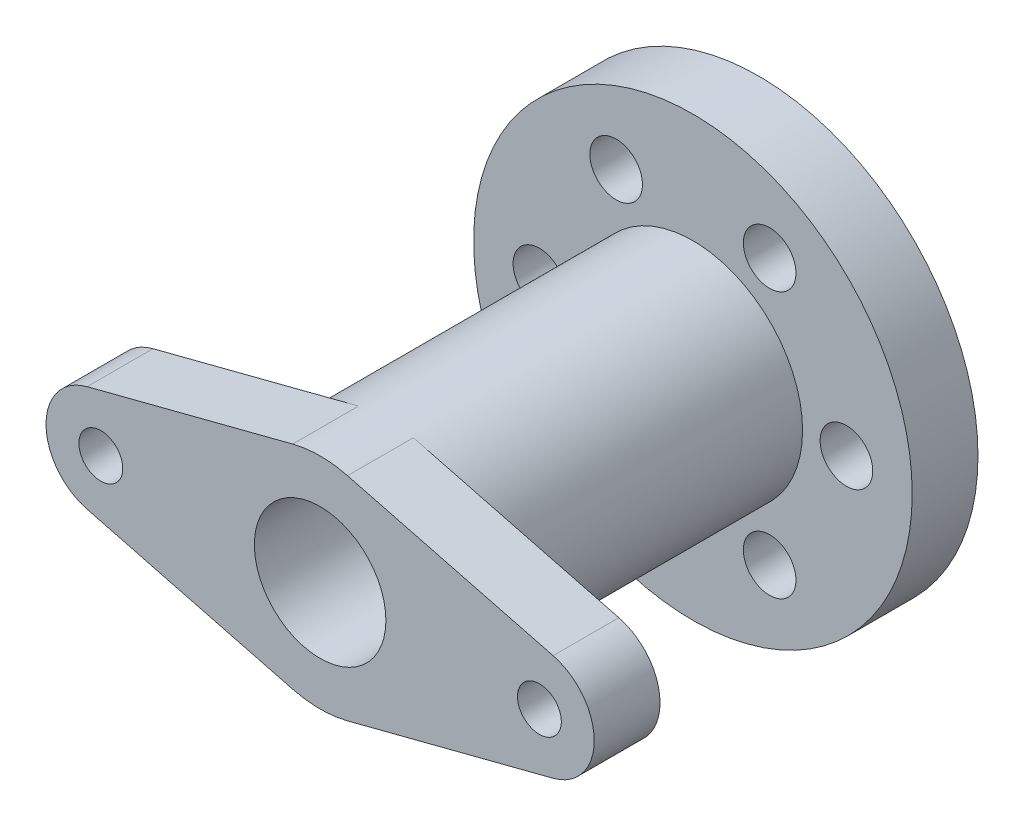
from build123d import *
from build123d.topology import SkipClean

# Parameters (mm, degrees)
BOSS_EXTRUDE1_START         = 15
SKETCH2_R                   = 5
BOSS_EXTRUDE1_DEPTH         = 15
SKETCH3_R                   = 15
CUT_EXTRUDE1_DEPTH          = 100
F_12_0MM_DOWEL_HOLE1_REACH  = 130.087
F_12_0MM_DOWEL_HOLE1_BORE_R = 6


with BuildPart() as part:
    # Sketch1 → Revolve1 (revolve)
    with BuildSketch(Plane(origin=(0, 0, 0), x_dir=(0, 0, -1), z_dir=(1, 0, 0)), mode=Mode.PRIVATE) as revolve1_sk:
        Polygon((85, 0), (85, 50), (70, 50), (70, 25), (0, 25), (0, 0), align=None)
    revolve(revolve1_sk.sketch.rotate(Axis((0, 0, 0), (0, 0, -1)), 90), axis=Axis((0, 0, 0), (0, 0, -1)))

    # Sketch2 → Boss-Extrude1 (add)
    with SkipClean():  # the faces are left unmerged after this step: merging them gives an invalid solid
        with BuildSketch(Plane.XY.offset(BOSS_EXTRUDE1_START)):
            with BuildLine():
                Line((-6.25, 24.206145914), (-53.125, 12.103072957))
                ThreePointArc((-53.125, 12.103072957), (-62.5, 0), (-53.125, -12.103072957))
                Line((-53.125, -12.103072957), (-6.25, -24.206145914))
                ThreePointArc((-6.25, -24.206145914), (0, -25), (6.25, -24.206145914))
                Line((6.25, -24.206145914), (53.125, -12.103072957))
                ThreePointArc((53.125, -12.103072957), (62.5, 0), (53.125, 12.103072957))
                Line((53.125, 12.103072957), (6.25, 24.206145914))
                ThreePointArc((6.25, 24.206145914), (0, 25), (-6.25, 24.206145914))
            make_face()
            with Locations((-50, 0)):
                Circle(SKETCH2_R, mode=Mode.SUBTRACT)
            with Locations((50, 0)):
                Circle(SKETCH2_R, mode=Mode.SUBTRACT)
        extrude(amount=-BOSS_EXTRUDE1_DEPTH)

    # Sketch3 → Cut-Extrude1 (cut)
    with SkipClean():  # the faces are left unmerged after this step: merging them gives an invalid solid
        with BuildSketch(Plane.XY.offset(15)):
            Circle(SKETCH3_R)
        extrude(amount=-CUT_EXTRUDE1_DEPTH, mode=Mode.SUBTRACT)

    # Ø12.0mm Dowel Hole1 bore → Ø12.0mm Dowel Hole1 (cut, up to next)
    with BuildSketch(Plane(origin=(0, 0, -85), x_dir=(-1, 0, 0), z_dir=(0, 0, -1)), mode=Mode.PRIVATE) as f_12_0mm_dowel_hole1_sk1:
        with Locations((-17.5, -30.310889132)):
            Circle(F_12_0MM_DOWEL_HOLE1_BORE_R)
    f_12_0mm_dowel_hole1_tool1 = extrude(f_12_0mm_dowel_hole1_sk1.sketch, amount=-F_12_0MM_DOWEL_HOLE1_REACH, mode=Mode.PRIVATE) & part.part
    # Ø12.0mm Dowel Hole1 bore → Ø12.0mm Dowel Hole1 (cut, up to next)
    with BuildSketch(Plane(origin=(0, 0, -85), x_dir=(-1, 0, 0), z_dir=(0, 0, -1)), mode=Mode.PRIVATE) as f_12_0mm_dowel_hole1_sk2:
        with Locations((-35, 0)):
            Circle(F_12_0MM_DOWEL_HOLE1_BORE_R)
    f_12_0mm_dowel_hole1_tool2 = extrude(f_12_0mm_dowel_hole1_sk2.sketch, amount=-F_12_0MM_DOWEL_HOLE1_REACH, mode=Mode.PRIVATE) & part.part
    # Ø12.0mm Dowel Hole1 bore → Ø12.0mm Dowel Hole1 (cut, up to next)
    with BuildSketch(Plane(origin=(0, 0, -85), x_dir=(-1, 0, 0), z_dir=(0, 0, -1)), mode=Mode.PRIVATE) as f_12_0mm_dowel_hole1_sk3:
        with Locations((-17.5, 30.310889132)):
            Circle(F_12_0MM_DOWEL_HOLE1_BORE_R)
    f_12_0mm_dowel_hole1_tool3 = extrude(f_12_0mm_dowel_hole1_sk3.sketch, amount=-F_12_0MM_DOWEL_HOLE1_REACH, mode=Mode.PRIVATE) & part.part
    # Ø12.0mm Dowel Hole1 bore → Ø12.0mm Dowel Hole1 (cut, up to next)
    with BuildSketch(Plane(origin=(0, 0, -85), x_dir=(-1, 0, 0), z_dir=(0, 0, -1)), mode=Mode.PRIVATE) as f_12_0mm_dowel_hole1_sk4:
        with Locations((17.5, 30.310889132)):
            Circle(F_12_0MM_DOWEL_HOLE1_BORE_R)
    f_12_0mm_dowel_hole1_tool4 = extrude(f_12_0mm_dowel_hole1_sk4.sketch, amount=-F_12_0MM_DOWEL_HOLE1_REACH, mode=Mode.PRIVATE) & part.part
    # Ø12.0mm Dowel Hole1 bore → Ø12.0mm Dowel Hole1 (cut, up to next)
    with BuildSketch(Plane(origin=(0, 0, -85), x_dir=(-1, 0, 0), z_dir=(0, 0, -1)), mode=Mode.PRIVATE) as f_12_0mm_dowel_hole1_sk5:
        with Locations((35, 0)):
            Circle(F_12_0MM_DOWEL_HOLE1_BORE_R)
    f_12_0mm_dowel_hole1_tool5 = extrude(f_12_0mm_dowel_hole1_sk5.sketch, amount=-F_12_0MM_DOWEL_HOLE1_REACH, mode=Mode.PRIVATE) & part.part
    # Ø12.0mm Dowel Hole1 bore → Ø12.0mm Dowel Hole1 (cut, up to next)
    with BuildSketch(Plane(origin=(0, 0, -85), x_dir=(-1, 0, 0), z_dir=(0, 0, -1)), mode=Mode.PRIVATE) as f_12_0mm_dowel_hole1_sk6:
        with Locations((17.5, -30.310889132)):
            Circle(F_12_0MM_DOWEL_HOLE1_BORE_R)
    f_12_0mm_dowel_hole1_tool6 = extrude(f_12_0mm_dowel_hole1_sk6.sketch, amount=-F_12_0MM_DOWEL_HOLE1_REACH, mode=Mode.PRIVATE) & part.part
    add(f_12_0mm_dowel_hole1_tool1.solids().sort_by_distance((17.5, -30.310889, -85))[0], mode=Mode.SUBTRACT)
    add(f_12_0mm_dowel_hole1_tool2.solids().sort_by_distance((35, 0, -85))[0], mode=Mode.SUBTRACT)
    add(f_12_0mm_dowel_hole1_tool3.solids().sort_by_distance((17.5, 30.310889, -85))[0], mode=Mode.SUBTRACT)
    add(f_12_0mm_dowel_hole1_tool4.solids().sort_by_distance((-17.5, 30.310889, -85))[0], mode=Mode.SUBTRACT)
    add(f_12_0mm_dowel_hole1_tool5.solids().sort_by_distance((-35, 0, -85))[0], mode=Mode.SUBTRACT)
    add(f_12_0mm_dowel_hole1_tool6.solids().sort_by_distance((-17.5, -30.310889, -85))[0], mode=Mode.SUBTRACT)


solid = part.part
